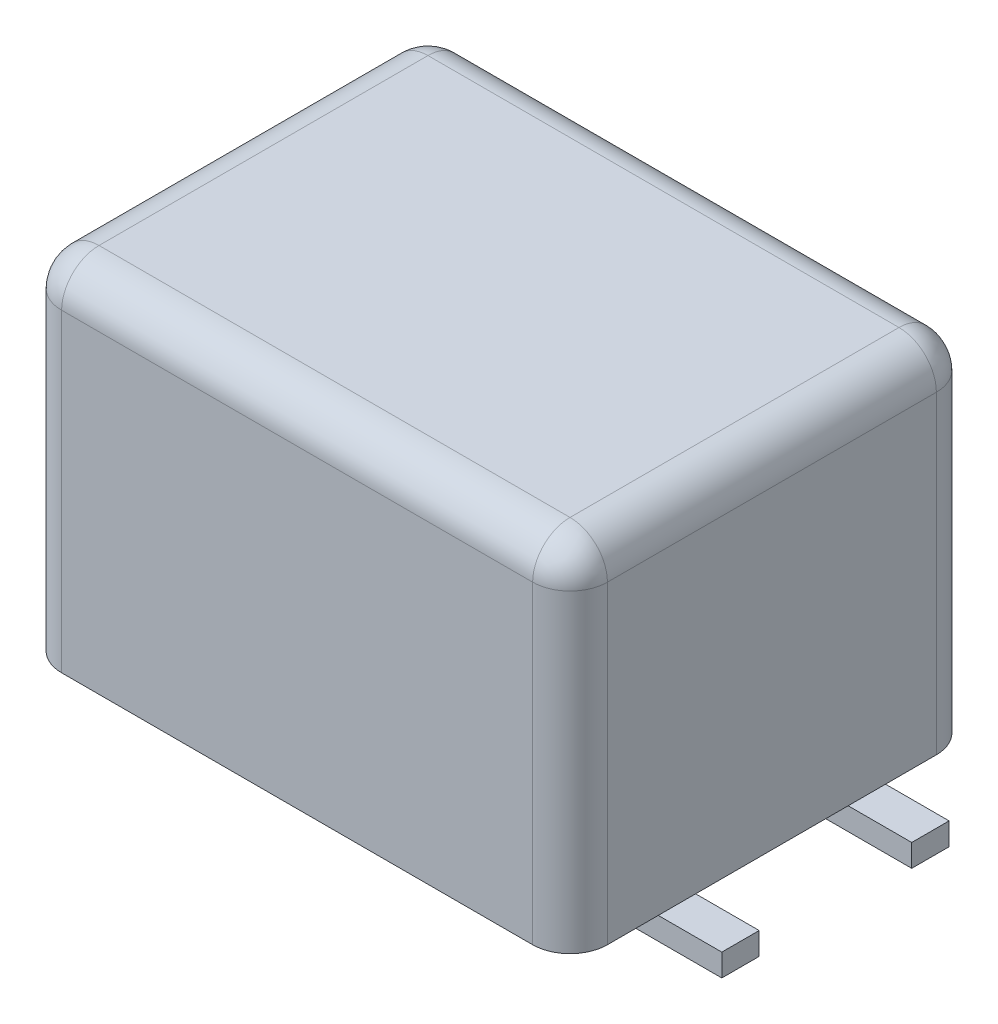
from build123d import *

# Parameters (mm, degrees)
BOSS_EXTRUDE1_START = 0.3
BOSS_EXTRUDE1_DEPTH = 4.7
SKETCH2_W           = 1.75
SKETCH2_H           = 0.5
BOSS_EXTRUDE2_DEPTH = 0.3
FILLET1_R           = 0.5


with BuildPart() as part:
    # Sketch1 → Boss-Extrude1 (new body)
    with BuildSketch(Plane(origin=(0, 0, 0), x_dir=(1, 0, 0), z_dir=(0, 1, 0)).offset(BOSS_EXTRUDE1_START)):
        with BuildLine():
            Line((-3.15, 2.7), (3.15, 2.7))
            ThreePointArc((3.15, 2.7), (3.503553391, 2.553553391), (3.65, 2.2))
            Line((3.65, 2.2), (3.65, -2.2))
            ThreePointArc((3.65, -2.2), (3.503553391, -2.553553391), (3.15, -2.7))
            Line((3.15, -2.7), (-3.15, -2.7))
            ThreePointArc((-3.15, -2.7), (-3.503553391, -2.553553391), (-3.65, -2.2))
            Line((-3.65, -2.2), (-3.65, 2.2))
            ThreePointArc((-3.65, 2.2), (-3.503553391, 2.553553391), (-3.15, 2.7))
        make_face()
    extrude(amount=BOSS_EXTRUDE1_DEPTH)

    # Sketch2 → Boss-Extrude2 (add)
    with BuildSketch(Plane(origin=(0, 0, 0), x_dir=(1, 0, 0), z_dir=(0, 1, 0))):
        with Locations((3.625, -1.27)):
            Rectangle(SKETCH2_W, SKETCH2_H)
        with Locations((3.625, 1.27)):
            Rectangle(SKETCH2_W, SKETCH2_H)
        with Locations((-3.625, 1.27)):
            Rectangle(SKETCH2_W, SKETCH2_H)
        with Locations((-3.625, -1.27)):
            Rectangle(SKETCH2_W, SKETCH2_H)
    extrude(amount=BOSS_EXTRUDE2_DEPTH)

    # Fillet1
    fillet1_edges = [part.edges().sort_by_distance(p)[0] for p in [
        (3.503553391, 5, -2.553553391),
        (0, 5, -2.7),
        (-3.503553391, 5, -2.553553391),
        (-3.65, 5, 0),
        (-3.503553391, 5, 2.553553391),
        (0, 5, 2.7),
        (3.503553391, 5, 2.553553391),
        (3.65, 5, 0),
    ]]
    fillet(fillet1_edges, radius=FILLET1_R)


solid = part.part
